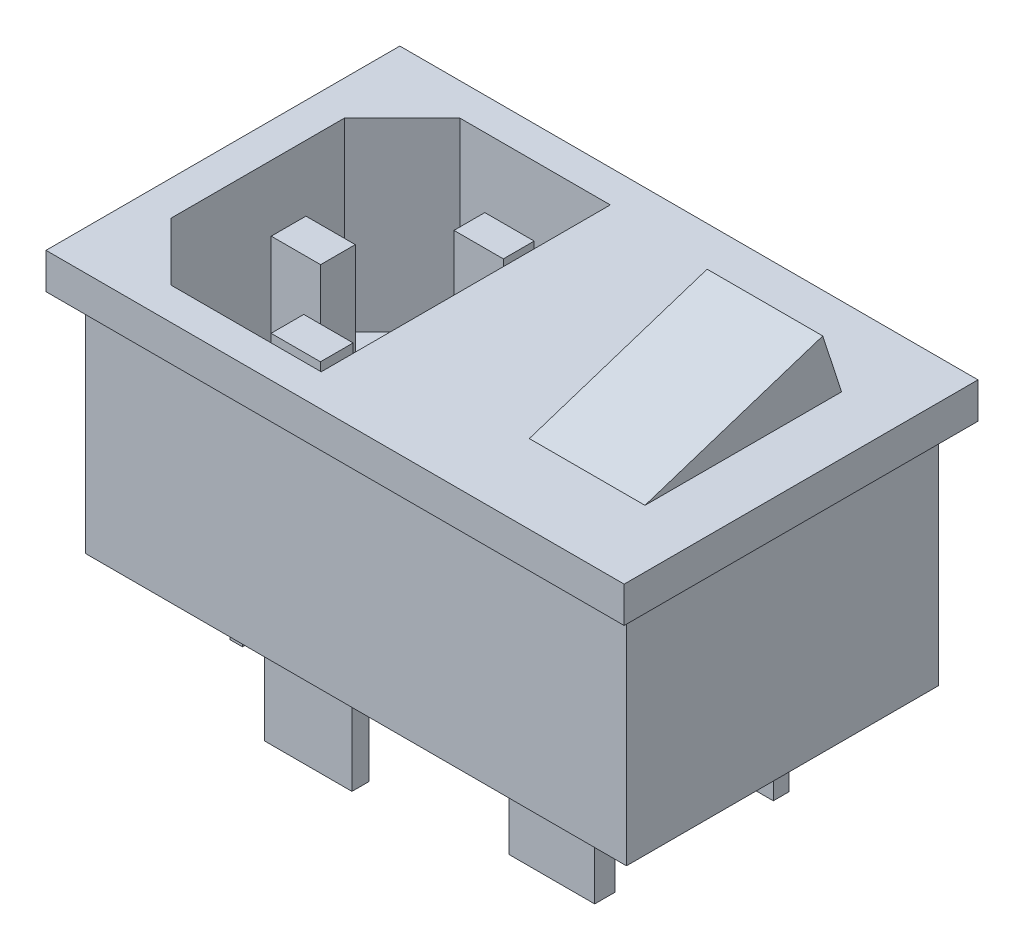
from build123d import *

# Parameters (mm, degrees)
SKETCH_1_W          = 50
SKETCH_1_H          = 30.6
EXTRUDE_1_DEPTH     = 3.1
SKETCH_2_W          = 46.8
SKETCH_2_H          = 27
EXTRUDE_2_DEPTH     = 19.7
CUT_EXTRUDE_1_DEPTH = 16
SKETCH_4_W          = 4.267620073
SKETCH_4_H          = 3.000670364
SKETCH_4_W_2        = 4.267620072
SKETCH_4_H_2        = 2.667262545
SKETCH_4_H_3        = 2.826910105
EXTRUDE_3_DEPTH     = 13
EXTRUDE_START       = -5
EXTRUDE_4_DEPTH     = 10
SKETCH_6_W          = 1.087762737
SKETCH_6_H          = 7.451174749
SKETCH_6_W_2        = 7.559951024
SKETCH_6_H_2        = 1.468479696
SKETCH_6_W_3        = 7.940667982
SKETCH_6_H_3        = 1.359703422
SKETCH_6_W_4        = 7.396786613
SKETCH_6_H_4        = 1.74042038
EXTRUDE_5_DEPTH     = 9


with BuildPart() as part:
    # 草图1 → 凸台-拉伸1 (new body)
    with BuildSketch(Plane(origin=(0, 0, 0), x_dir=(1, 0, 0), z_dir=(0, 1, 0))):
        Rectangle(SKETCH_1_W, SKETCH_1_H)
    extrude(amount=EXTRUDE_1_DEPTH)

    # 草图2 → 凸台-拉伸2 (add)
    with BuildSketch(Plane.XZ):
        Rectangle(SKETCH_2_W, SKETCH_2_H)
    extrude(amount=EXTRUDE_2_DEPTH)

    # 草图3 → 切除-拉伸1 (cut)
    with BuildSketch(Plane(origin=(0, 3.1, 0), x_dir=(1, 0, 0), z_dir=(0, 1, 0))):
        Polygon((-17, 12.5), (-4, 12.5), (-4, -12.5), (-17, -12.5), (-22, -7.5), (-22, 7.5), align=None)
    extrude(amount=-CUT_EXTRUDE_1_DEPTH, mode=Mode.SUBTRACT)

    # 草图4 → 凸台-拉伸3 (add)
    with BuildSketch(Plane(origin=(0, -12.9, 0), x_dir=(1, 0, 0), z_dir=(0, 1, 0))):
        with Locations((-17.186695536, 0)):
            Rectangle(SKETCH_4_W, SKETCH_4_H)
        with Locations((-9.718360408, 8.168491546)):
            Rectangle(SKETCH_4_W_2, SKETCH_4_H_2)
        with Locations((-9.918405099, -7.368312782)):
            Rectangle(SKETCH_4_W_2, SKETCH_4_H_3)
    extrude(amount=EXTRUDE_3_DEPTH)

    # 草图5 → 凸台-拉伸4 (add)
    with BuildSketch(Plane(origin=(25, 0, 0), x_dir=(0, 0, -1), z_dir=(1, 0, 0)).offset(EXTRUDE_START)):
        Polygon((-8.5, 3.1), (6.873863542, 8.1), (8.5, 3.1), align=None)
    extrude(amount=-EXTRUDE_4_DEPTH)

    # 草图6 → 凸台-拉伸5 (add)
    with BuildSketch(Plane.XZ.offset(19.7)):
        with Locations((-19.144624175, 0.978986463)):
            Rectangle(SKETCH_6_W, SKETCH_6_H)
        with Locations((-6.825711176, 10.061805319)):
            Rectangle(SKETCH_6_W_2, SKETCH_6_H_2)
        with Locations((-6.635352697, -7.396786613)):
            Rectangle(SKETCH_6_W_3, SKETCH_6_H_3)
        with Locations((12.182942656, 7.859085776)):
            Rectangle(SKETCH_6_W_4, SKETCH_6_H_4)
        with Locations((12.182942656, -7.396786613)):
            Rectangle(SKETCH_6_W_4, SKETCH_6_H_3)
    extrude(amount=EXTRUDE_5_DEPTH)


solid = part.part
